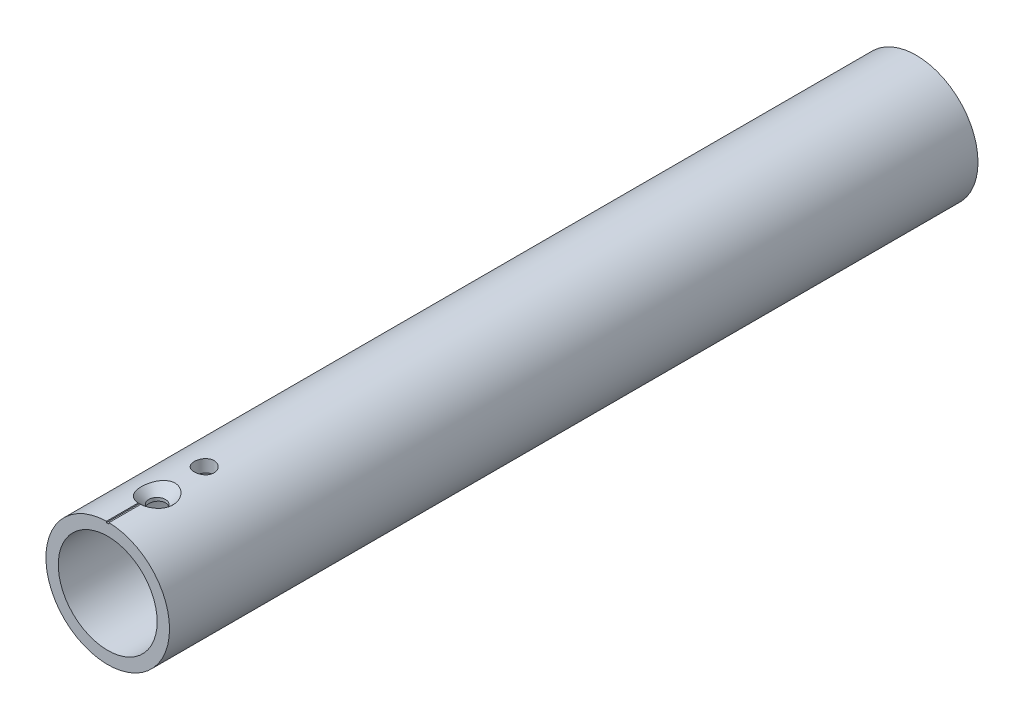
from build123d import *

# Parameters (mm, degrees)
SKETCH1_R                     = 12.5
SKETCH1_R_2                   = 10
BOSS_EXTRUDE1_DEPTH           = 163.5
CSK_FOR_M3_SFHCS1_D           = 3.4
CSK_FOR_M3_SFHCS1_DEPTH       = 10
CSK_FOR_M3_SFHCS1_CSINK_D     = 7.22
CSK_FOR_M3_SFHCS1_CSINK_ANGLE = 90
CSK_FOR_M3_SFHCS1_TIP         = 1.021463052
F_4_0MM_DOWEL_HOLE1_D         = 4
SKETCH8_W                     = 10
SKETCH8_H                     = 0.5
CUT_EXTRUDE1_DEPTH            = 0.25


with BuildPart() as part:
    # Sketch1 → Boss-Extrude1 (new body)
    with BuildSketch(Plane.XY):
        Circle(SKETCH1_R)
        Circle(SKETCH1_R_2, mode=Mode.SUBTRACT)
    extrude(amount=-BOSS_EXTRUDE1_DEPTH)

    # CSK for M3 SFHCS1
    with Locations(Plane.ZX.offset(12.5)):
        with Locations((-10, 0)):
            CounterSinkHole(CSK_FOR_M3_SFHCS1_D / 2, CSK_FOR_M3_SFHCS1_CSINK_D / 2, depth=CSK_FOR_M3_SFHCS1_DEPTH, counter_sink_angle=CSK_FOR_M3_SFHCS1_CSINK_ANGLE)
            with Locations((0, 0, -(CSK_FOR_M3_SFHCS1_DEPTH + CSK_FOR_M3_SFHCS1_TIP / 2))):  # 118° drill point
                Cone(0, CSK_FOR_M3_SFHCS1_D / 2, CSK_FOR_M3_SFHCS1_TIP, mode=Mode.SUBTRACT)

    # Ø4.0mm Dowel Hole1 (through all)
    with Locations(Plane.ZX.offset(12.5)):
        with Locations((-19.5, 0)):
            Hole(F_4_0MM_DOWEL_HOLE1_D / 2)

    # Sketch8 → Cut-Extrude1 (cut)
    with BuildSketch(Plane.ZX.offset(12.5)):
        with Locations((-5, 0)):
            Rectangle(SKETCH8_W, SKETCH8_H)
    extrude(amount=-CUT_EXTRUDE1_DEPTH, mode=Mode.SUBTRACT)


solid = part.part
